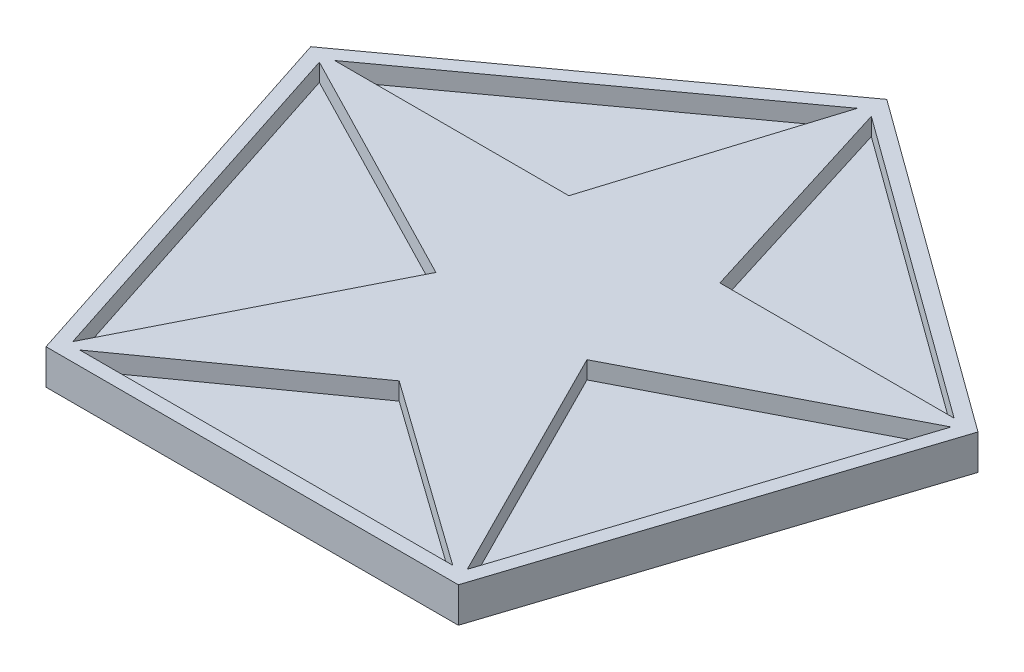
from build123d import *

# Parameters (mm, degrees)
BOSS_EXTRUDE1_DEPTH = 1
BOSS_EXTRUDE2_DEPTH = 0.5


with BuildPart() as part:
    # Sketch1 → Boss-Extrude1 (new body)
    with BuildSketch(Plane(origin=(0, 0, 0), x_dir=(1, 0, 0), z_dir=(0, 1, 0))):
        Polygon((5.877852523, -8.090169944), (9.510565163, 3.090169944), (0, 10), (-9.510565163, 3.090169944), (-5.877852523, -8.090169944), align=None)
        Polygon((-5.316743775, -7.690169944), (5.316743775, -7.690169944), (0, -3.9), align=None, mode=Mode.SUBTRACT)
        Polygon((5.622138751, -7.582748818), (2.153438567, -0.699694605), (9.005433722, 2.829962413), align=None, mode=Mode.SUBTRACT)
        Polygon((8.830044516, 3.090169944), (2.153438567, 3.090169944), (0.199189097, 9.360853459), align=None, mode=Mode.SUBTRACT)
        Polygon((-0.199189097, 9.360853459), (-2.153438567, 3.090169944), (-8.830044516, 3.090169944), align=None, mode=Mode.SUBTRACT)
        Polygon((-9.005433722, 2.829962413), (-2.153438567, -0.699694605), (-5.622138751, -7.582748818), align=None, mode=Mode.SUBTRACT)
    extrude(amount=BOSS_EXTRUDE1_DEPTH)

    # Sketch1<2> → Boss-Extrude2 (add)
    with BuildSketch(Plane(origin=(0, 0, 0), x_dir=(1, 0, 0), z_dir=(0, 1, 0))):
        Polygon((0, -3.9), (-5.316743775, -7.690169944), (5.316743775, -7.690169944), align=None)
        Polygon((2.153438567, -0.699694605), (5.622138751, -7.582748818), (9.005433722, 2.829962413), align=None)
        Polygon((2.153438567, 3.090169944), (8.830044516, 3.090169944), (0.199189097, 9.360853459), align=None)
        Polygon((-2.153438567, 3.090169944), (-0.199189097, 9.360853459), (-8.830044516, 3.090169944), align=None)
        Polygon((-2.153438567, -0.699694605), (-9.005433722, 2.829962413), (-5.622138751, -7.582748818), align=None)
    extrude(amount=BOSS_EXTRUDE2_DEPTH)


solid = part.part
